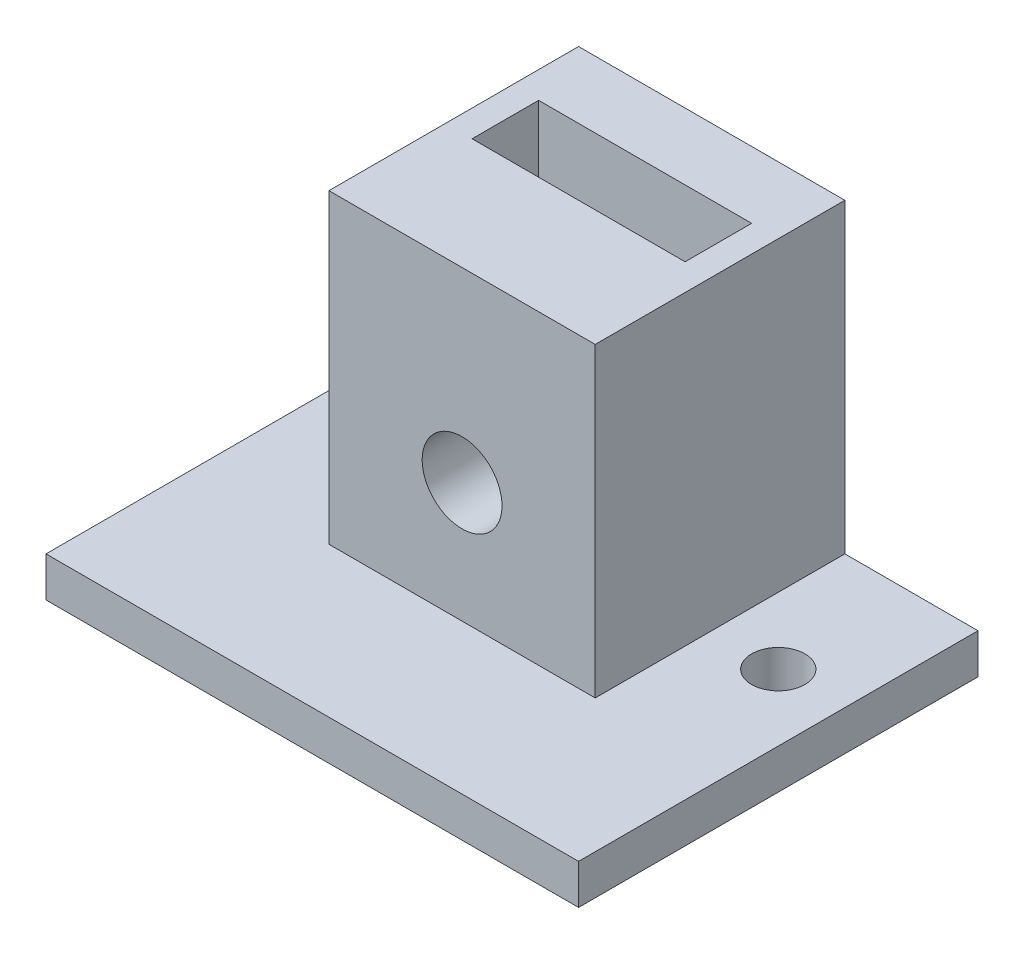
from build123d import *

# Parameters (mm, degrees)
ESQUISSE3_W             = 10
ESQUISSE3_H             = 15
ESQUISSE3_H_2           = 10
ESQUISSE3_H_3           = 5
BOSS_EXTRU_1_DEPTH      = 3
ESQUISSE4_W             = 10
ESQUISSE4_H             = 5
ESQUISSE4_H_2           = 3.75
BOSS_EXTRU_2_DEPTH      = 17
ENL_V_MAT_EXTRU_1_DEPTH = 5
ENL_V_MAT_EXTRU_2_DEPTH = 18.75
ESQUISSE8_W             = 20
ESQUISSE8_H             = 18.75
ESQUISSE8_W_2           = 16
ESQUISSE8_H_2           = 5
BOSS_EXTRU_3_DEPTH      = 6


with BuildPart() as part:
    # Esquisse3 → Boss.-Extru.1 (new body)
    with BuildSketch(Plane(origin=(0, 0, 0), x_dir=(1, 0, 0), z_dir=(0, 1, 0))):
        with Locations((-15.05164944, -6.870348765)):
            Rectangle(ESQUISSE3_W, ESQUISSE3_H)
        with Locations((14.94835056, -6.870348765)):
            Rectangle(ESQUISSE3_W, ESQUISSE3_H)
        with BuildLine():
            Line((-10.05164944, 5.629651235), (-10.05164944, 15.629651235))
            Line((-10.05164944, 15.629651235), (-20.05164944, 15.629651235))
            Line((-20.05164944, 15.629651235), (-20.05164944, 5.629651235))
            Line((-20.05164944, 5.629651235), (-17.05164944, 5.629651235))
            ThreePointArc((-17.05164944, 5.629651235), (-15.05164944, 7.629651235), (-13.05164944, 5.629651235))
            Line((-13.05164944, 5.629651235), (-10.05164944, 5.629651235))
        make_face()
        with BuildLine():
            Line((-10.05164944, 0.629651235), (-10.05164944, 5.629651235))
            Line((-10.05164944, 5.629651235), (-13.05164944, 5.629651235))
            ThreePointArc((-13.05164944, 5.629651235), (-15.05164944, 3.629651235), (-17.05164944, 5.629651235))
            Line((-17.05164944, 5.629651235), (-20.05164944, 5.629651235))
            Line((-20.05164944, 5.629651235), (-20.05164944, 0.629651235))
            Line((-20.05164944, 0.629651235), (-10.05164944, 0.629651235))
        make_face()
        with Locations((-5.05164944, 10.629651235)):
            Rectangle(ESQUISSE3_W, ESQUISSE3_H_2)
        with Locations((4.94835056, 10.629651235)):
            Rectangle(ESQUISSE3_W, ESQUISSE3_H_2)
        with BuildLine():
            Line((19.94835056, 15.629651235), (9.94835056, 15.629651235))
            Line((9.94835056, 15.629651235), (9.94835056, 5.629651235))
            Line((9.94835056, 5.629651235), (12.94835056, 5.629651235))
            ThreePointArc((12.94835056, 5.629651235), (14.94835056, 7.629651235), (16.94835056, 5.629651235))
            Line((16.94835056, 5.629651235), (19.94835056, 5.629651235))
            Line((19.94835056, 5.629651235), (19.94835056, 15.629651235))
        make_face()
        with BuildLine():
            Line((12.94835056, 5.629651235), (9.94835056, 5.629651235))
            Line((9.94835056, 5.629651235), (9.94835056, 0.629651235))
            Line((9.94835056, 0.629651235), (19.94835056, 0.629651235))
            Line((19.94835056, 0.629651235), (19.94835056, 5.629651235))
            Line((19.94835056, 5.629651235), (16.94835056, 5.629651235))
            ThreePointArc((16.94835056, 5.629651235), (14.94835056, 3.629651235), (12.94835056, 5.629651235))
        make_face()
        with Locations((4.94835056, -6.870348765)):
            Rectangle(ESQUISSE3_W, ESQUISSE3_H)
        with Locations((-5.05164944, -6.870348765)):
            Rectangle(ESQUISSE3_W, ESQUISSE3_H)
        with Locations((4.94835056, 3.129651235)):
            Rectangle(ESQUISSE3_W, ESQUISSE3_H_3)
        with Locations((-5.05164944, 3.129651235)):
            Rectangle(ESQUISSE3_W, ESQUISSE3_H_3)
    extrude(amount=BOSS_EXTRU_1_DEPTH)

    # Esquisse4 → Boss.-Extru.2 (add)
    with BuildSketch(Plane(origin=(0, 3, 0), x_dir=(1, 0, 0), z_dir=(0, 1, 0))):
        with Locations((-5.05164944, 3.129651235)):
            Rectangle(ESQUISSE4_W, ESQUISSE4_H)
        with Locations((-5.05164944, -1.245348765)):
            Rectangle(ESQUISSE4_W, ESQUISSE4_H_2)
        with Locations((4.94835056, -1.245348765)):
            Rectangle(ESQUISSE4_W, ESQUISSE4_H_2)
        with Locations((4.94835056, 3.129651235)):
            Rectangle(ESQUISSE4_W, ESQUISSE4_H)
        Polygon((-0.05164944, 15.629651235), (-0.05164944, 5.629651235), (9.94835056, 5.629651235), (9.94835056, 8.129651235), align=None)
        Polygon((-10.05164944, 8.129651235), (-10.05164944, 5.629651235), (-0.05164944, 5.629651235), (-0.05164944, 15.629651235), align=None)
        Polygon((-10.05164944, 15.629651235), (-10.05164944, 8.129651235), (-0.05164944, 15.629651235), align=None)
        Polygon((9.94835056, 15.629651235), (-0.05164944, 15.629651235), (9.94835056, 8.129651235), align=None)
    extrude(amount=BOSS_EXTRU_2_DEPTH)

    # Esquisse6 → Enlèv. mat.-Extru.1 (cut)
    with BuildSketch(Plane(origin=(0, 0, -10.629651235), x_dir=(-1, 0, 0), z_dir=(0, 0, -1))):
        with BuildLine():
            Line((8.05164944, 20), (-7.94835056, 20))
            Line((-7.94835056, 20), (-7.94835056, 12))
            ThreePointArc((-7.94835056, 12), (0.05164944, 4), (8.05164944, 12))
            Line((8.05164944, 12), (8.05164944, 20))
        make_face()
    extrude(amount=-ENL_V_MAT_EXTRU_1_DEPTH, mode=Mode.SUBTRACT)

    # Esquisse7 → Enlèv. mat.-Extru.2 (cut)
    with BuildSketch(Plane(origin=(0, 0, -15.629651235), x_dir=(-1, 0, 0), z_dir=(0, 0, -1))):
        with BuildLine():
            ThreePointArc((3.05164944, 12), (2.823288037, 13.148050297), (2.172969783, 14.121320344))
            Line((2.172969783, 14.121320344), (0.05164944, 12))
            Line((0.05164944, 12), (2.172969783, 9.878679656))
            ThreePointArc((2.172969783, 9.878679656), (2.823288037, 10.851949703), (3.05164944, 12))
        make_face()
        with BuildLine():
            Line((0.05164944, 12), (2.172969783, 14.121320344))
            ThreePointArc((2.172969783, 14.121320344), (0.05164944, 15), (-2.069670904, 14.121320344))
            Line((-2.069670904, 14.121320344), (0.05164944, 12))
        make_face()
        with BuildLine():
            ThreePointArc((-2.069670904, 9.878679656), (0.05164944, 9), (2.172969783, 9.878679656))
            Line((2.172969783, 9.878679656), (0.05164944, 12))
            Line((0.05164944, 12), (-2.069670904, 9.878679656))
        make_face()
        with BuildLine():
            Line((0.05164944, 12), (-2.069670904, 14.121320344))
            ThreePointArc((-2.069670904, 14.121320344), (-2.94835056, 12), (-2.069670904, 9.878679656))
            Line((-2.069670904, 9.878679656), (0.05164944, 12))
        make_face()
    extrude(amount=-ENL_V_MAT_EXTRU_2_DEPTH, mode=Mode.SUBTRACT)

    # Esquisse8 → Boss.-Extru.3 (add)
    with BuildSketch(Plane(origin=(0, 20, 0), x_dir=(1, 0, 0), z_dir=(0, 1, 0))):
        with Locations((-0.05164944, 6.254651235)):
            Rectangle(ESQUISSE8_W, ESQUISSE8_H)
        with Locations((-0.05164944, 8.129651235)):
            Rectangle(ESQUISSE8_W_2, ESQUISSE8_H_2, mode=Mode.SUBTRACT)
    extrude(amount=BOSS_EXTRU_3_DEPTH)


solid = part.part
